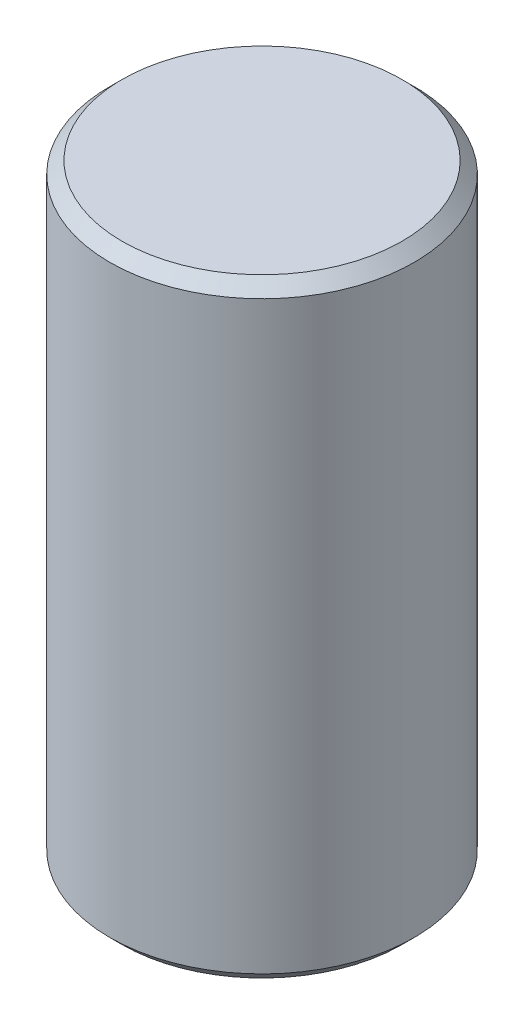
from build123d import *

# Parameters (mm, degrees)
SKETCH1_R           = 1.25
BOSS_EXTRUDE1_DEPTH = 2.5
CHAMFER1_SIZE       = 0.1


with BuildPart() as part:
    # Sketch1 → Boss-Extrude1 (new, symmetric)
    with BuildSketch(Plane(origin=(0, 0, 0), x_dir=(1, 0, 0), z_dir=(0, 1, 0))):
        with Locations(Location((0, 0, 0), (0, 0, 270))):
            Circle(SKETCH1_R)
    extrude(amount=BOSS_EXTRUDE1_DEPTH, both=True)

    # Chamfer1
    chamfer1_edges = [part.edges().sort_by_distance(p)[0] for p in [
        (0, -2.5, -1.25),
        (0, 2.5, -1.25),
    ]]
    chamfer(chamfer1_edges, length=CHAMFER1_SIZE)


solid = part.part
